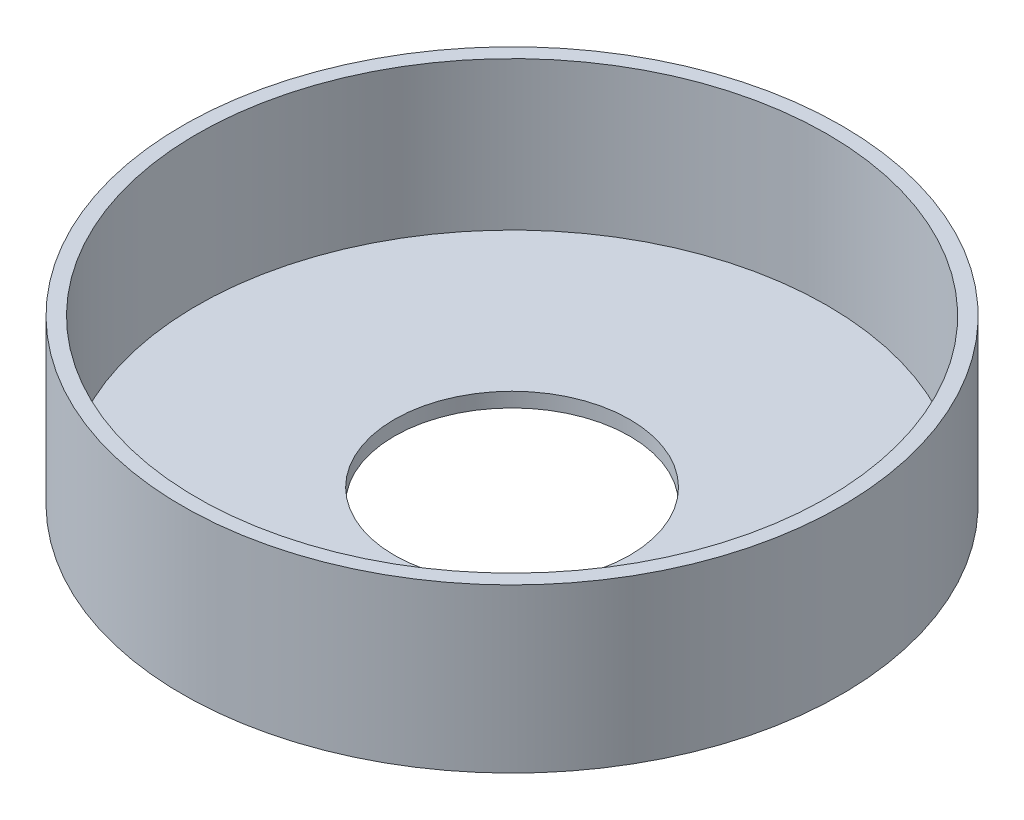
from build123d import *


with BuildPart() as part:
    # Croquis1 → Revolución1 (revolve)
    with BuildSketch(Plane.XY, mode=Mode.PRIVATE) as revoluci_n1_sk:
        Polygon((3.25, 0), (9.1, 0), (9.1, 4.5), (8.7, 4.5), (8.7, 0.4), (3.25, 0.4), align=None)
    revolve(revoluci_n1_sk.sketch.rotate(Axis((0, 0, 0), (0, 1, 0)), 90), axis=Axis((0, 0, 0), (0, 1, 0)))


solid = part.part
